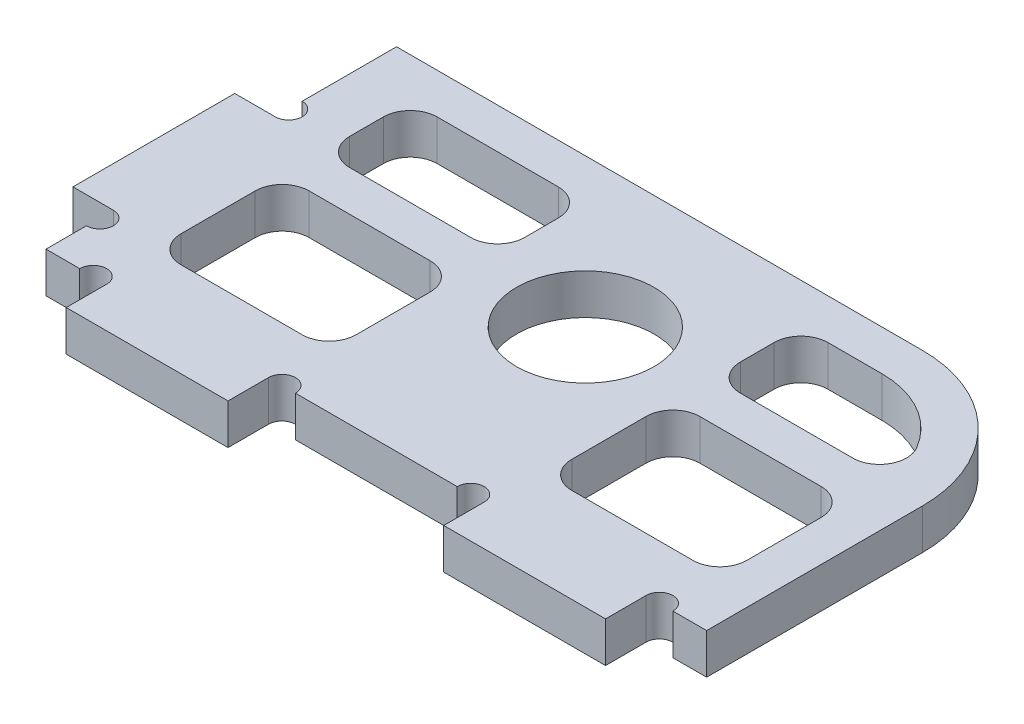
from build123d import *

# Parameters (mm, degrees)
SKETCH_1_W          = 49
SKETCH_1_H          = 26
SKETCH_1_R          = 5.1
EXTRUDE_1_DEPTH     = 3
SKETCH_5_W          = 3
SKETCH_5_H          = 12
EXTRUDE_2_DEPTH     = 3
SKETCH_2_W          = 12
SKETCH_2_H          = 3
EXTRUDE_3_DEPTH     = 3
SKETCH_8_R          = 1
CUT_EXTRUDE_5_DEPTH = 32.957002363
FILLET_1_R          = 10
SKETCH_6_W          = 12.982120022
SKETCH_6_H          = 9.5
SKETCH_6_H_2        = 6.5
CUT_EXTRUDE_3_DEPTH = 32.957002363
FILLET_2_R          = 2


with BuildPart() as part:
    # 草图1 → 凸台-拉伸1 (new body)
    with BuildSketch(Plane(origin=(0, 0, 0), x_dir=(1, 0, 0), z_dir=(0, 1, 0))):
        Rectangle(SKETCH_1_W, SKETCH_1_H)
        with Locations(Location((0.5, 2, 0), (0, 0, 270))):
            Circle(SKETCH_1_R, mode=Mode.SUBTRACT)
    extrude(amount=EXTRUDE_1_DEPTH)

    # 草图5 → 凸台-拉伸2 (add)
    with BuildSketch(Plane.XZ):
        with Locations((-26, 2)):
            Rectangle(SKETCH_5_W, SKETCH_5_H)
    extrude(amount=-EXTRUDE_2_DEPTH)

    # 草图2 → 凸台-拉伸3 (add)
    with BuildSketch(Plane(origin=(0, 3, 0), x_dir=(1, 0, 0), z_dir=(0, 1, 0))):
        with Locations((-14, -14.5)):
            Rectangle(SKETCH_2_W, SKETCH_2_H)
        with Locations((14, -14.5)):
            Rectangle(SKETCH_2_W, SKETCH_2_H)
    extrude(amount=-EXTRUDE_3_DEPTH)

    # 草图8 → 切除-拉伸5 (cut, through all)
    with BuildSketch(Plane(origin=(0, 3, 0), x_dir=(1, 0, 0), z_dir=(0, 1, 0))):
        with Locations((21, -13)):
            Circle(SKETCH_8_R)
        with Locations((7, -13)):
            Circle(SKETCH_8_R)
        with Locations((-7, -13)):
            Circle(SKETCH_8_R)
        with Locations((-21, -13)):
            Circle(SKETCH_8_R)
        with Locations((-24.5, -9)):
            Circle(SKETCH_8_R)
        with Locations((-24.5, 5)):
            Circle(SKETCH_8_R)
    extrude(amount=-CUT_EXTRUDE_5_DEPTH, mode=Mode.SUBTRACT)

    # 圆角1
    fillet_1_edges = [part.edges().sort_by_distance(p)[0] for p in [
        (24.5, 1.5, -13),
    ]]
    fillet(fillet_1_edges, radius=FILLET_1_R)

    # 草图6 → 切除-拉伸3 (cut, through all)
    with BuildSketch(Plane(origin=(0, 3, 0), x_dir=(1, 0, 0), z_dir=(0, 1, 0))):
        with Locations((-13.991060011, -4.25)):
            Rectangle(SKETCH_6_W, SKETCH_6_H)
        with Locations((-13.991060011, 6.75)):
            Rectangle(SKETCH_6_W, SKETCH_6_H_2)
        with Locations((14.991060011, -4.25)):
            Rectangle(SKETCH_6_W, SKETCH_6_H)
        with BuildLine():
            Line((8.5, 3.5), (8.5, 10))
            Line((8.5, 10), (14.5, 10))
            ThreePointArc((14.5, 10), (19.269696007, 8.123475383), (21.482120022, 3.5))
            Line((21.482120022, 3.5), (8.5, 3.5))
        make_face()
    extrude(amount=-CUT_EXTRUDE_3_DEPTH, mode=Mode.SUBTRACT)

    # 圆角2
    fillet_2_edges = [part.edges().sort_by_distance(p)[0] for p in [
        (-20.482120022, 1.5, -3.5),
        (-20.482120022, 1.5, -10),
        (-7.5, 1.5, -10),
        (-7.5, 1.5, -3.5),
        (21.482120022, 1.5, -0.5),
        (21.482120022, 1.5, 9),
        (8.5, 1.5, 9),
        (8.5, 1.5, -0.5),
        (8.5, 1.5, -10),
        (21.482120022, 1.5, -3.5),
        (8.5, 1.5, -3.5),
        (-20.482120022, 1.5, 9),
        (-20.482120022, 1.5, -0.5),
        (-7.5, 1.5, -0.5),
        (-7.5, 1.5, 9),
    ]]
    fillet(fillet_2_edges, radius=FILLET_2_R)


solid = part.part
